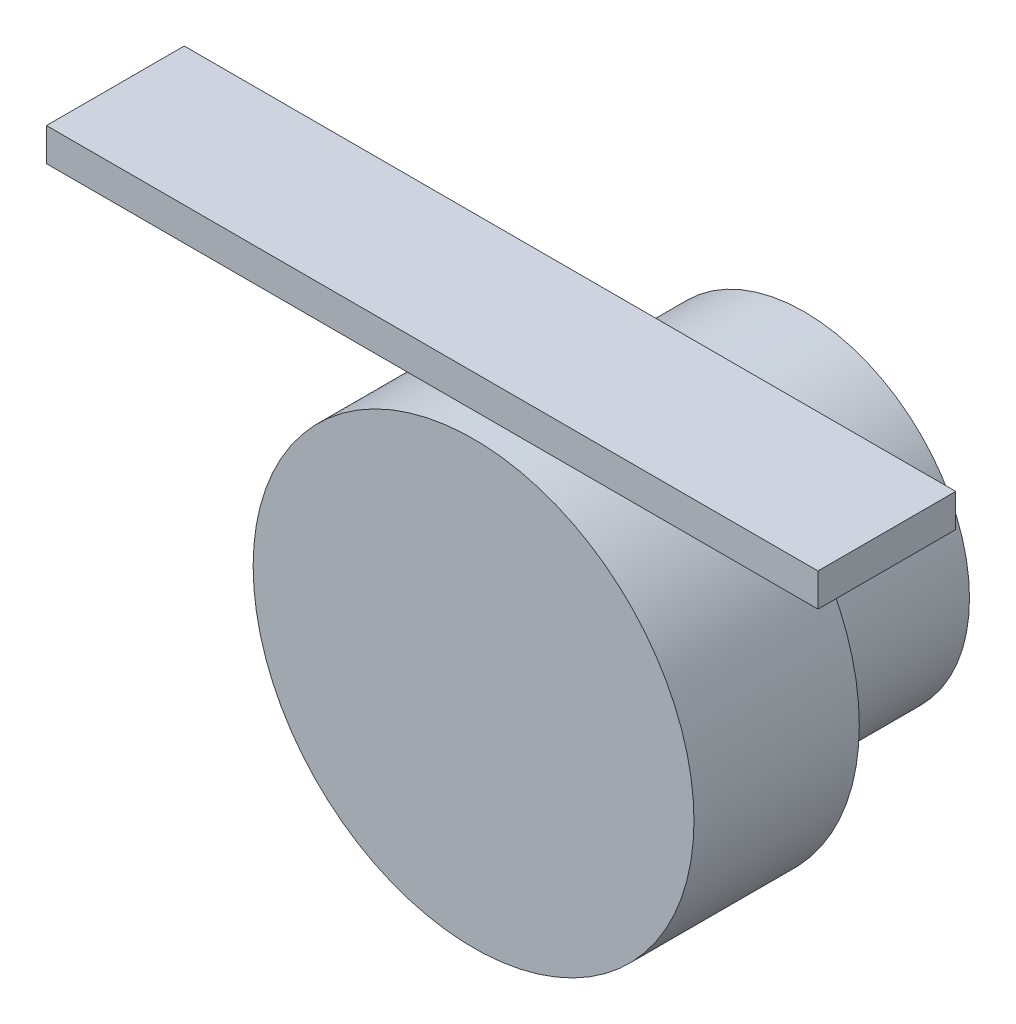
from build123d import *

# Parameters (mm, degrees)
TOP_START                                  = -3
SKETCH_1_R                                 = 8
TOP_WAKE_BUTTON_CAP_DIA_16_MM_DEPTH        = 6
BUTTON_START                               = -9
SKETCH_2_R                                 = 6
BUTTON_THREADED_BODY_HOLE_MARKER_DIA_DEPTH = 8
BUTTON_START_2                             = -0.5
SKETCH_3_W                                 = 28
SKETCH_3_H                                 = 1.2
BUTTON_LABEL_PLATE_WAKE_BTN_DEPTH          = 5


with BuildPart() as part:
    # 草图1 → top wake button cap - dia 16 mm (new body)
    with BuildSketch(Plane.XY.offset(TOP_START)):
        Circle(SKETCH_1_R)
    extrude(amount=TOP_WAKE_BUTTON_CAP_DIA_16_MM_DEPTH)


with BuildPart() as body_2:
    # 草图2 → button threaded body / hole marker - dia 12 mm (new body)
    with BuildSketch(Plane.XY.offset(BUTTON_START)):
        Circle(SKETCH_2_R)
    extrude(amount=BUTTON_THREADED_BODY_HOLE_MARKER_DIA_DEPTH)


with BuildPart() as body_3:
    # 草图3 → button label plate - WAKE BTN (new body)
    with BuildSketch(Plane.XY.offset(BUTTON_START_2)):
        with Locations((0, 11)):
            Rectangle(SKETCH_3_W, SKETCH_3_H)
    extrude(amount=BUTTON_LABEL_PLATE_WAKE_BTN_DEPTH)


solid = Compound([part.part, body_2.part, body_3.part])
